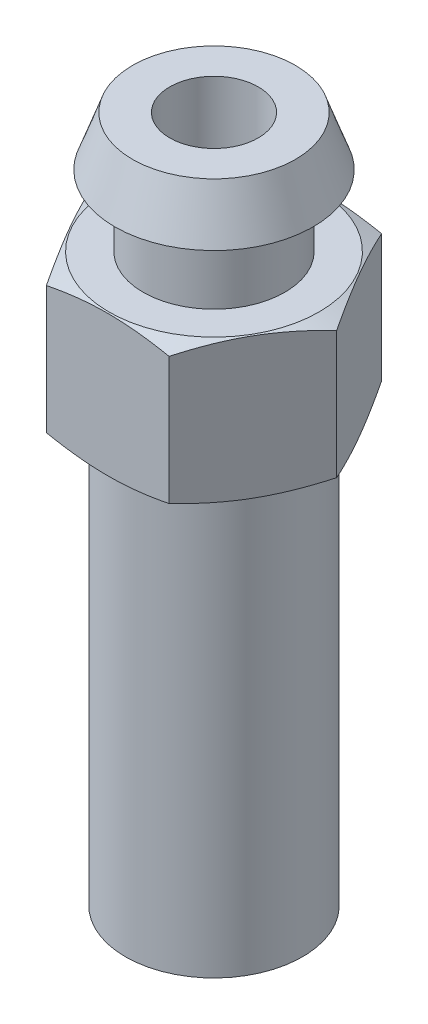
from build123d import *

# Parameters (mm, degrees)
BOSS_EXTRUDE1_DEPTH = 5.08
SKETCH2_R           = 2.54
BOSS_EXTRUDE2_DEPTH = 2.54
SKETCH4_R           = 2.921
SKETCH3_R           = 3.556
SKETCH7_R           = 3.175
BOSS_EXTRUDE3_DEPTH = 15.24
SKETCH8_R           = 1.5875
CUT_EXTRUDE1_DEPTH  = 26.316041239


with BuildPart() as part:
    # Sketch1 → Boss-Extrude1 (new body)
    with BuildSketch(Plane(origin=(0, 0, 0), x_dir=(1, 0, 0), z_dir=(0, 1, 0))):
        Polygon((2.199704526, 3.81), (-2.199704526, 3.81), (-4.399409051, 0), (-2.199704526, -3.81), (2.199704526, -3.81), (4.399409051, 0), align=None)
    extrude(amount=BOSS_EXTRUDE1_DEPTH)

    # Sketch2 → Boss-Extrude2 (add)
    with BuildSketch(Plane(origin=(0, 5.08, 0), x_dir=(1, 0, 0), z_dir=(0, 1, 0))):
        with Locations(Location((0, 0, 0), (0, 0, 270))):
            Circle(SKETCH2_R)
    extrude(amount=BOSS_EXTRUDE2_DEPTH)

    # Sketch4 → Loft1 section 0
    with BuildSketch(Plane(origin=(0, 9.398, 0), x_dir=(1, 0, 0), z_dir=(0, 1, 0))):
        Circle(SKETCH4_R)
    # Sketch3 → Loft1 section 1
    with BuildSketch(Plane(origin=(0, 7.62, 0), x_dir=(1, 0, 0), z_dir=(0, 1, 0))):
        Circle(SKETCH3_R)
    loft()

    # Sketch6 → Cut-Revolve1 (revolve, cut)
    with BuildSketch(Plane.XY):
        Polygon((4.399409051, 4.826), (3.764409051, 5.08), (4.399409051, 5.08), align=None)
        Polygon((4.399409051, 0), (4.399409051, 0.254), (3.764409051, 0), align=None)
    revolve(axis=Axis((0, 0, 0), (0, 1, 0)), mode=Mode.SUBTRACT)

    # Sketch7 → Boss-Extrude3 (add)
    with BuildSketch(Plane.XZ):
        with Locations(Location((0, 0, 0), (0, 0, 90))):
            Circle(SKETCH7_R)
    extrude(amount=BOSS_EXTRUDE3_DEPTH)

    # Sketch8 → Cut-Extrude1 (cut, through all)
    with BuildSketch(Plane(origin=(0, 9.398, 0), x_dir=(1, 0, 0), z_dir=(0, 1, 0))):
        with Locations(Location((0, 0, 0), (0, 0, 270))):
            Circle(SKETCH8_R)
    extrude(amount=-CUT_EXTRUDE1_DEPTH, mode=Mode.SUBTRACT)


solid = part.part
